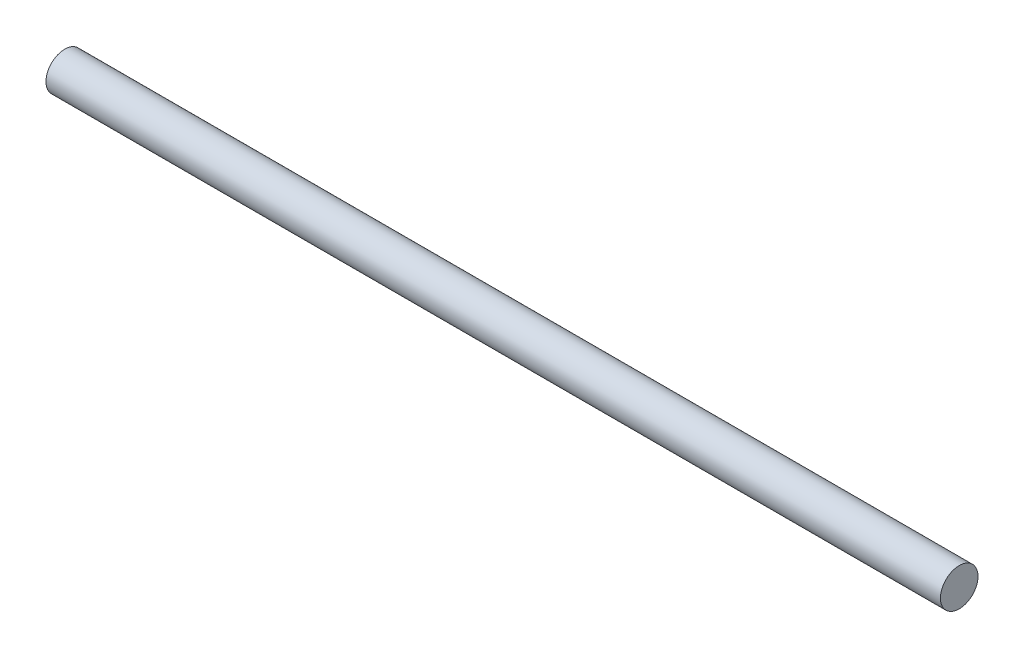
from build123d import *

# Parameters (mm, degrees)
SKETCH1_R           = 2.667
BOSS_EXTRUDE1_DEPTH = 127


with BuildPart() as part:
    # Sketch1 → Boss-Extrude1 (new body)
    with BuildSketch(Plane(origin=(0, 0, 0), x_dir=(0, 0, -1), z_dir=(1, 0, 0))):
        Circle(SKETCH1_R)
    extrude(amount=BOSS_EXTRUDE1_DEPTH)


solid = part.part
